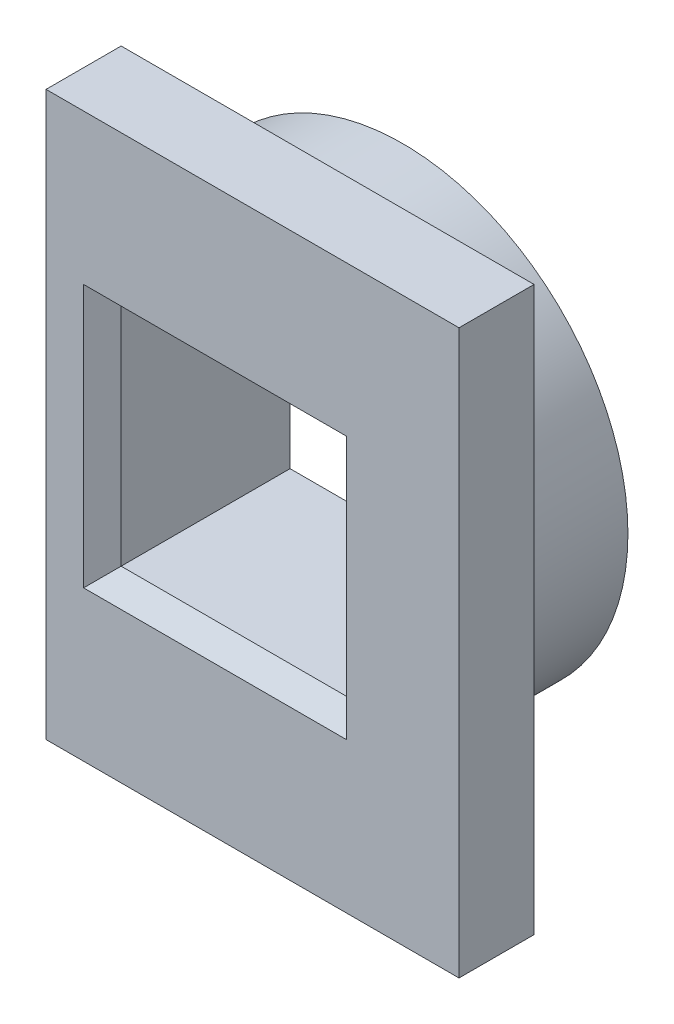
from build123d import *

# Parameters (mm, degrees)
SKETCH1_R           = 6
BOSS_EXTRUDE1_DEPTH = 3
SKETCH2_W           = 11
SKETCH2_H           = 15
BOSS_EXTRUDE2_DEPTH = 2
SKETCH3_W           = 6
SKETCH3_H           = 6
CUT_EXTRUDE1_DEPTH  = 12.113055385
CHAMFER1_SIZE       = 0.5


with BuildPart() as part:
    # Sketch1 → Boss-Extrude1 (new body)
    with BuildSketch(Plane.XY):
        Circle(SKETCH1_R)
    extrude(amount=BOSS_EXTRUDE1_DEPTH)

    # Sketch2 → Boss-Extrude2 (add)
    with BuildSketch(Plane.XY.offset(3)):
        with Locations((1, 0)):
            Rectangle(SKETCH2_W, SKETCH2_H)
    extrude(amount=BOSS_EXTRUDE2_DEPTH)

    # Sketch3 → Cut-Extrude1 (cut, through all)
    with BuildSketch(Plane(origin=(0, 0, 0), x_dir=(-1, 0, 0), z_dir=(0, 0, -1))):
        Rectangle(SKETCH3_W, SKETCH3_H)
    extrude(amount=-CUT_EXTRUDE1_DEPTH, mode=Mode.SUBTRACT)

    # Chamfer1
    chamfer1_edges = [part.edges().sort_by_distance(p)[0] for p in [
        (3, 0, 5),
        (0, 3, 5),
        (-3, 0, 5),
        (0, -3, 5),
    ]]
    chamfer(chamfer1_edges, length=CHAMFER1_SIZE)


solid = part.part
